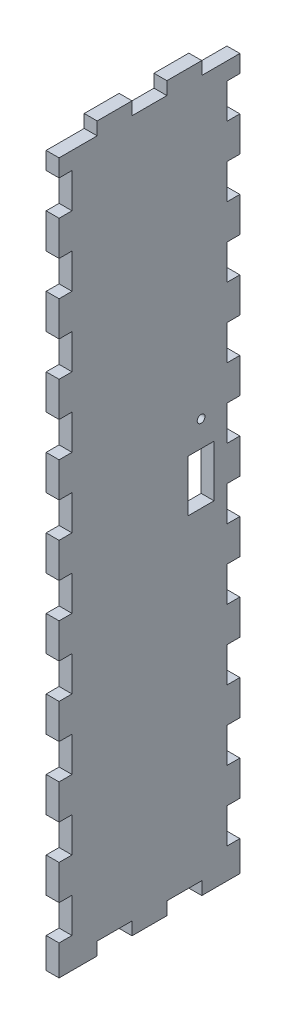
from build123d import *

# Parameters (mm, degrees)
SKETCH1_W           = 12.7
SKETCH1_H           = 25.4
SKETCH1_R           = 1.905
BOSS_EXTRUDE1_DEPTH = 6.35


with BuildPart() as part:
    # Sketch1 → Boss-Extrude1 (new body)
    with BuildSketch(Plane(origin=(0, 0, 0), x_dir=(0, 0, -1), z_dir=(1, 0, 0))):
        Polygon((0, 14.9225), (0, 6.35), (0, 0), (6.35, 0), (18.7325, 0), (18.7325, 6.35), (35.8775, 6.35), (35.8775, 0), (53.0225, 0), (53.0225, 6.35), (70.1675, 6.35), (70.1675, 0), (82.55, 0), (88.9, 0), (88.9, 6.35), (88.9, 14.9225), (82.55, 14.9225), (82.55, 32.0675), (88.9, 32.0675), (88.9, 49.2125), (82.55, 49.2125), (82.55, 66.3575), (88.9, 66.3575), (88.9, 83.5025), (82.55, 83.5025), (82.55, 100.6475), (88.9, 100.6475), (88.9, 117.7925), (82.55, 117.7925), (82.55, 134.9375), (88.9, 134.9375), (88.9, 152.0825), (82.55, 152.0825), (82.55, 169.2275), (88.9, 169.2275), (88.9, 186.3725), (82.55, 186.3725), (82.55, 203.5175), (88.9, 203.5175), (88.9, 220.6625), (82.55, 220.6625), (82.55, 237.8075), (88.9, 237.8075), (88.9, 254.9525), (82.55, 254.9525), (82.55, 272.0975), (88.9, 272.0975), (88.9, 289.2425), (82.55, 289.2425), (82.55, 306.3875), (88.9, 306.3875), (88.9, 323.5325), (82.55, 323.5325), (82.55, 340.6775), (88.9, 340.6775), (88.9, 349.25), (70.1675, 349.25), (70.1675, 355.6), (53.0225, 355.6), (53.0225, 349.25), (35.8775, 349.25), (35.8775, 355.6), (18.7325, 355.6), (18.7325, 349.25), (6.35, 349.25), (0, 349.25), (0, 340.6775), (6.35, 340.6775), (6.35, 334.518000001), (6.35, 329.692000001), (6.35, 323.5325), (0, 323.5325), (0, 306.3875), (6.35, 306.3875), (6.35, 289.2425), (0, 289.2425), (0, 272.0975), (6.35, 272.0975), (6.35, 254.9525), (0, 254.9525), (0, 237.8075), (6.35, 237.8075), (6.35, 220.6625), (0, 220.6625), (0, 203.5175), (6.35, 203.5175), (6.35, 186.3725), (0, 186.3725), (0, 169.2275), (6.35, 169.2275), (6.35, 152.0825), (0, 152.0825), (0, 134.9375), (6.35, 134.9375), (6.35, 117.7925), (0, 117.7925), (0, 100.6475), (6.35, 100.6475), (6.35, 83.5025), (0, 83.5025), (0, 66.3575), (6.35, 66.3575), (6.35, 49.2125), (0, 49.2125), (0, 32.0675), (6.35, 32.0675), (6.35, 25.907999999), (6.35, 21.081999999), (6.35, 14.9225), align=None)
        with Locations((69.85, 177.8)):
            Rectangle(SKETCH1_W, SKETCH1_H, mode=Mode.SUBTRACT)
        with Locations((69.85, 203.2)):
            Circle(SKETCH1_R, mode=Mode.SUBTRACT)
    extrude(amount=BOSS_EXTRUDE1_DEPTH)


solid = part.part
